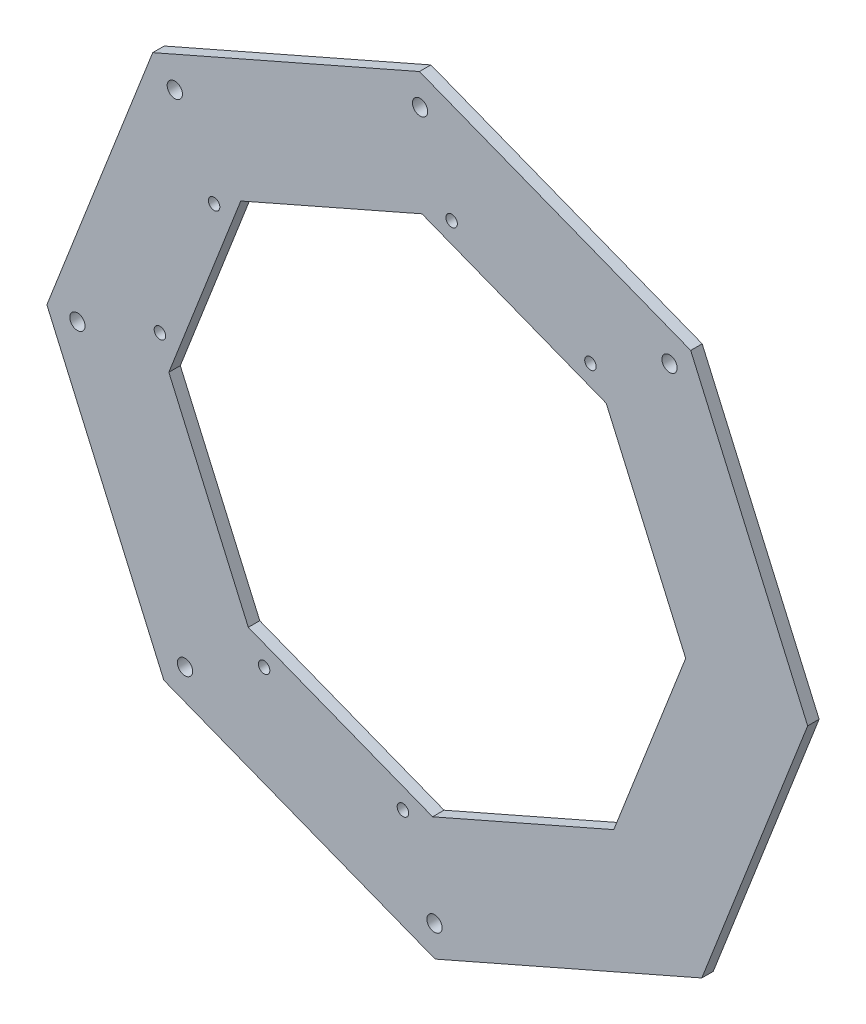
from build123d import *

# Parameters (mm, degrees)
SALIENTE_EXTRUIR1_DEPTH = 3
CROQUIS2_R              = 1.5
CORTAR_EXTRUIR1_DEPTH   = 141.829538188
CROQUIS3_R              = 2
CORTAR_EXTRUIR2_DEPTH   = 141.829538188


with BuildPart() as part:
    # Croquis1 → Saliente-Extruir1 (new body)
    with BuildSketch(Plane.XY):
        Polygon((-99.558924327, -2.052657564), (-68.947342436, -71.850238602), (2.052657564, -99.558924327), (71.850238602, -68.947342436), (99.558924327, 2.052657564), (68.947342436, 71.850238602), (-2.052657564, 99.558924327), (-71.850238602, 68.947342436), align=None)
    extrude(amount=SALIENTE_EXTRUIR1_DEPTH)

    # Croquis2 → Cortar-Extruir1 (cut, through all)
    with BuildSketch(Plane.XY.offset(3)):
        with Locations((6.374524738, 69.970461156)):
            Circle(CROQUIS2_R)
        with Locations(Location((42.705814706, 55.791696428, 0), (0, 0, 180))):
            Circle(CROQUIS2_R)
        with Locations((-6.374524738, -69.970461156)):
            Circle(CROQUIS2_R)
        with Locations(Location((-42.705814706, -55.791696428, 0), (0, 0, 180))):
            Circle(CROQUIS2_R)
        with Locations((-69.970461156, 6.374524738)):
            Circle(CROQUIS2_R)
        with Locations(Location((-55.791696428, 42.705814706, 0), (0, 0, 180))):
            Circle(CROQUIS2_R)
        Polygon((-67.635138809, -1.394468454), (-46.839227198, -48.811303398), (1.394468454, -67.635138809), (48.811303398, -46.839227198), (67.635138809, 1.394468454), (46.839227198, 48.811303398), (-1.394468454, 67.635138809), (-48.811303398, 46.839227198), align=None)
    extrude(amount=-CORTAR_EXTRUIR1_DEPTH, mode=Mode.SUBTRACT)

    # Croquis3 → Cortar-Extruir2 (cut, through all)
    with BuildSketch(Plane.XY.offset(3)):
        with Locations((-1.887752493, 91.560624112)):
            Circle(CROQUIS3_R)
        with Locations((63.40829561, 66.077980789)):
            Circle(CROQUIS3_R)
        with Locations((1.887752493, -91.560624112)):
            Circle(CROQUIS3_R)
        with Locations((-63.40829561, -66.077980789)):
            Circle(CROQUIS3_R)
        with Locations((-91.560624112, -1.887752493)):
            Circle(CROQUIS3_R)
        with Locations((-66.077980789, 63.40829561)):
            Circle(CROQUIS3_R)
    extrude(amount=-CORTAR_EXTRUIR2_DEPTH, mode=Mode.SUBTRACT)


solid = part.part
